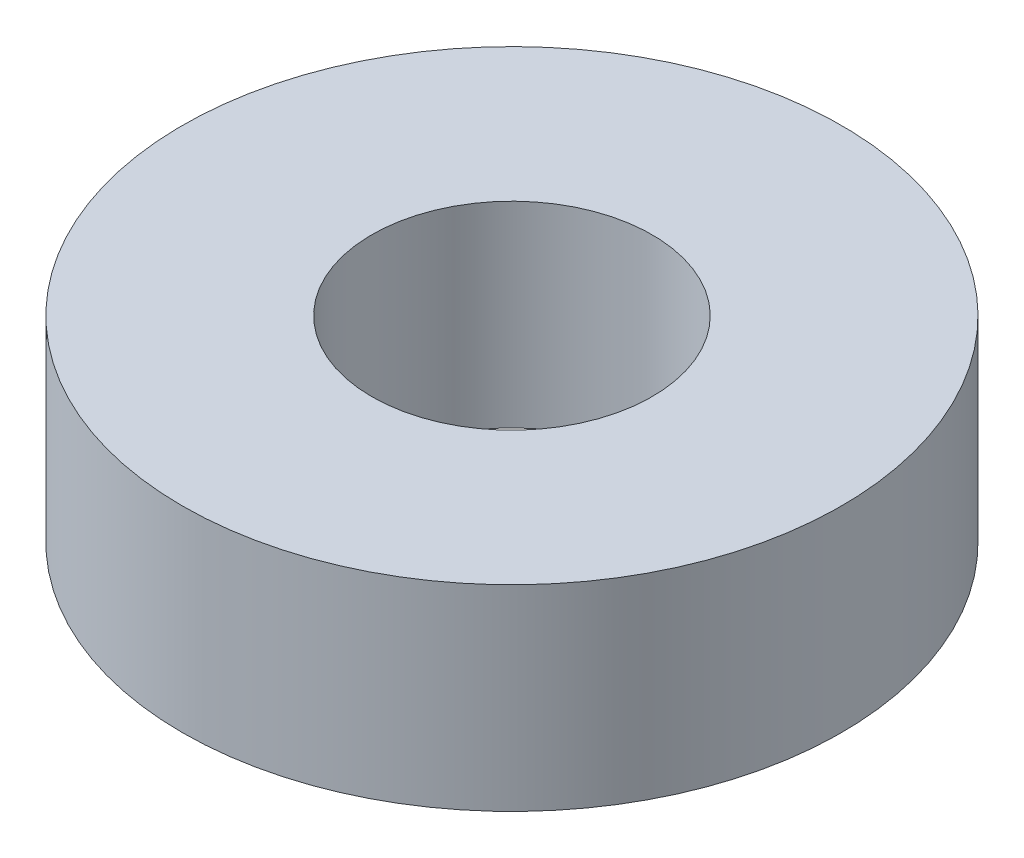
from build123d import *

# Parameters (mm, degrees)
SKETCH1_R           = 23.5
SKETCH1_R_2         = 10
BOSS_EXTRUDE1_DEPTH = 14


with BuildPart() as part:
    # Sketch1 → Boss-Extrude1 (new body)
    with BuildSketch(Plane(origin=(0, 0, 0), x_dir=(1, 0, 0), z_dir=(0, 1, 0))):
        with Locations(Location((0, 0, 0), (0, 0, 270))):
            Circle(SKETCH1_R)
        with Locations(Location((0, 0, 0), (0, 0, 270))):
            Circle(SKETCH1_R_2, mode=Mode.SUBTRACT)
    extrude(amount=BOSS_EXTRUDE1_DEPTH)


solid = part.part
